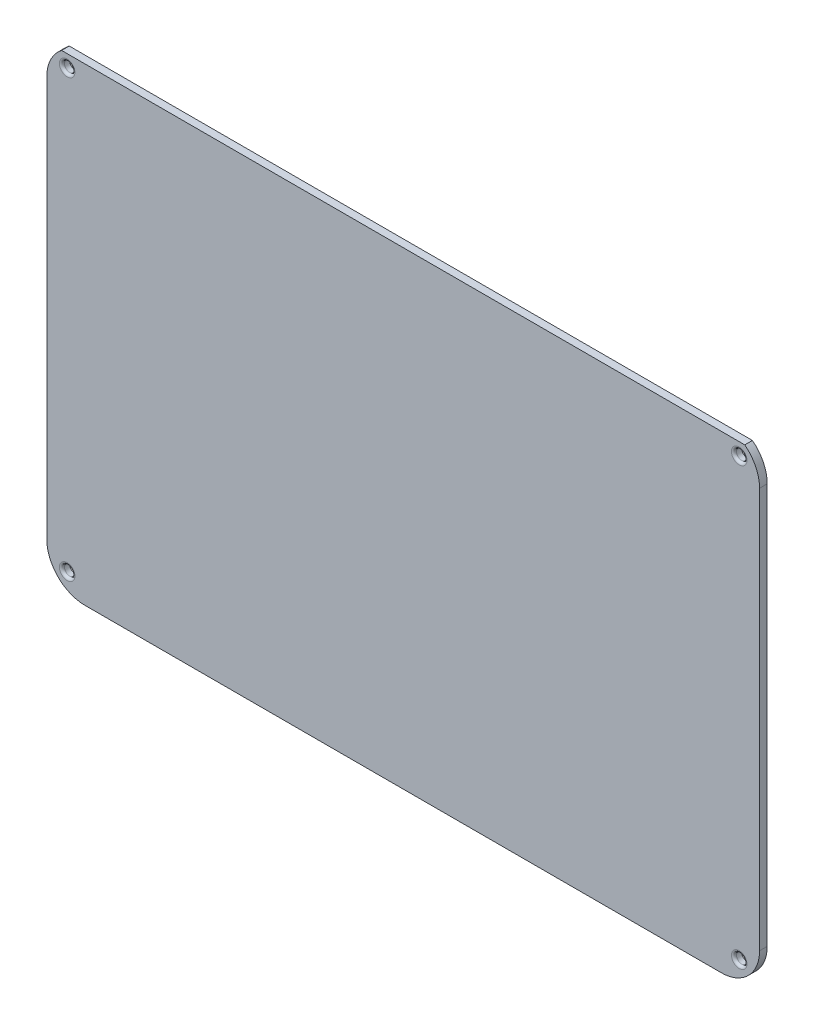
from build123d import *

# Parameters (mm, degrees)
SKETCH2_R           = 2.05
BOSS_EXTRUDE1_DEPTH = 3
BOSS_EXTRUDE2_DEPTH = 3
FILLET1_R           = 1


with BuildPart() as part:
    # Sketch2 → Boss-Extrude1 (new body)
    # profile 1 of 2: a face of its own
    with BuildSketch(Plane(origin=(0, 0, 0), x_dir=(-1, 0, 0), z_dir=(0, 0, 1))):
        with BuildLine():
            Line((125, 0), (-125, 0))
            ThreePointArc((-125, 0), (-135.606601718, -4.393398282), (-140, -15))
            Line((-140, -15), (-140, -172.349939952))
            ThreePointArc((-140, -172.349939952), (-138.469261815, -178.951378141), (-134.189468511, -184.205473195))
            Line((-134.189468511, -184.205473195), (134.189468511, -184.205473195))
            ThreePointArc((134.189468511, -184.205473195), (138.469261815, -178.951378141), (140, -172.349939952))
            Line((140, -172.349939952), (140, -15))
            ThreePointArc((140, -15), (135.606601718, -4.393398282), (125, 0))
        make_face()
        with Locations(Location((132, -179.349939952, 0), (0, 0, 180))):
            Circle(SKETCH2_R, mode=Mode.SUBTRACT)
        with Locations(Location((132, -8, 0), (0, 0, 180))):
            Circle(SKETCH2_R, mode=Mode.SUBTRACT)
        with Locations(Location((-132, -8, 0), (0, 0, 180))):
            Circle(SKETCH2_R, mode=Mode.SUBTRACT)
        with Locations(Location((-132, -179.349939952, 0), (0, 0, 180))):
            Circle(SKETCH2_R, mode=Mode.SUBTRACT)
        with BuildLine():
            ThreePointArc((127, -10), (126.414213562, -8.585786438), (125, -8))
            Line((125, -8), (-125, -8))
            ThreePointArc((-125, -8), (-126.414213562, -8.585786438), (-127, -10))
            Line((-127, -10), (-127, -177.349939952))
            ThreePointArc((-127, -177.349939952), (-126.414213562, -178.764153514), (-125, -179.349939952))
            Line((-125, -179.349939952), (125, -179.349939952))
            ThreePointArc((125, -179.349939952), (126.414213562, -178.764153514), (127, -177.349939952))
            Line((127, -177.349939952), (127, -10))
        make_face(mode=Mode.SUBTRACT)
    # profile 2 of 2: a face of its own
    with BuildSketch(Plane(origin=(0, 0, 0), x_dir=(-1, 0, 0), z_dir=(0, 0, 1))):
        with BuildLine():
            Line((127, -10), (127, -177.349939952))
            ThreePointArc((127, -177.349939952), (126.414213562, -178.764153514), (125, -179.349939952))
            Line((125, -179.349939952), (-125, -179.349939952))
            ThreePointArc((-125, -179.349939952), (-126.414213562, -178.764153514), (-127, -177.349939952))
            Line((-127, -177.349939952), (-127, -10))
            ThreePointArc((-127, -10), (-126.414213562, -8.585786438), (-125, -8))
            Line((-125, -8), (125, -8))
            ThreePointArc((125, -8), (126.414213562, -8.585786438), (127, -10))
        make_face()
    extrude(amount=BOSS_EXTRUDE1_DEPTH)

    # Sketch3 → Boss-Extrude2 (add)
    with BuildSketch(Plane(origin=(0, 0, 0), x_dir=(-1, 0, 0), z_dir=(0, 0, -1))):
        with BuildLine():
            Line((-126.6, 177.349939952), (-126.6, 10))
            ThreePointArc((-126.6, 10), (-126.13137085, 8.86862915), (-125, 8.4))
            Line((-125, 8.4), (125, 8.4))
            ThreePointArc((125, 8.4), (126.13137085, 8.86862915), (126.6, 10))
            Line((126.6, 10), (126.6, 177.349939952))
            ThreePointArc((126.6, 177.349939952), (126.13137085, 178.481310802), (125, 178.949939952))
            Line((125, 178.949939952), (-125, 178.949939952))
            ThreePointArc((-125, 178.949939952), (-126.13137085, 178.481310802), (-126.6, 177.349939952))
        make_face()
    extrude(amount=BOSS_EXTRUDE2_DEPTH)

    # Fillet1
    fillet1_edges = [part.edges().sort_by_distance(p)[0] for p in [
        (-134.05, 8, 3),
        (129.95, 8, 3),
        (129.95, 179.349939952, 3),
        (-134.05, 179.349939952, 3),
    ]]
    fillet(fillet1_edges, radius=FILLET1_R)


solid = part.part
